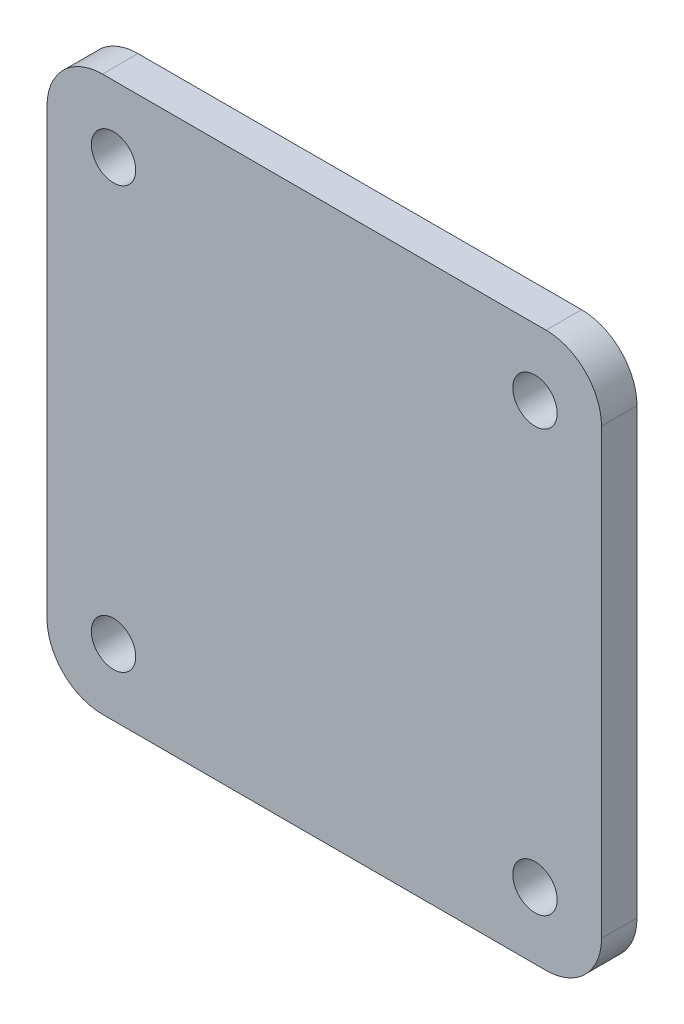
from build123d import *

# Parameters (mm, degrees)
SKETCH_1_W      = 25
SKETCH_1_H      = 25
SKETCH_1_R      = 1
EXTRUDE_1_DEPTH = 1.6
FILLET_1_R      = 2.5


with BuildPart() as part:
    # 草图1 → 凸台-拉伸1 (new body)
    with BuildSketch(Plane.XY):
        Rectangle(SKETCH_1_W, SKETCH_1_H)
        with Locations((-9.5, 9.5)):
            Circle(SKETCH_1_R, mode=Mode.SUBTRACT)
        with Locations(Location((9.5, 9.5, 0), (0, 0, 180))):
            Circle(SKETCH_1_R, mode=Mode.SUBTRACT)
        with Locations((9.5, -9.5)):
            Circle(SKETCH_1_R, mode=Mode.SUBTRACT)
        with Locations(Location((-9.5, -9.5, 0), (0, 0, 180))):
            Circle(SKETCH_1_R, mode=Mode.SUBTRACT)
    extrude(amount=EXTRUDE_1_DEPTH)

    # 圆角1
    fillet_1_edges = [part.edges().sort_by_distance(p)[0] for p in [
        (12.5, -12.5, 0.8),
        (-12.5, -12.5, 0.8),
        (-12.5, 12.5, 0.8),
        (12.5, 12.5, 0.8),
    ]]
    fillet(fillet_1_edges, radius=FILLET_1_R)


solid = part.part
